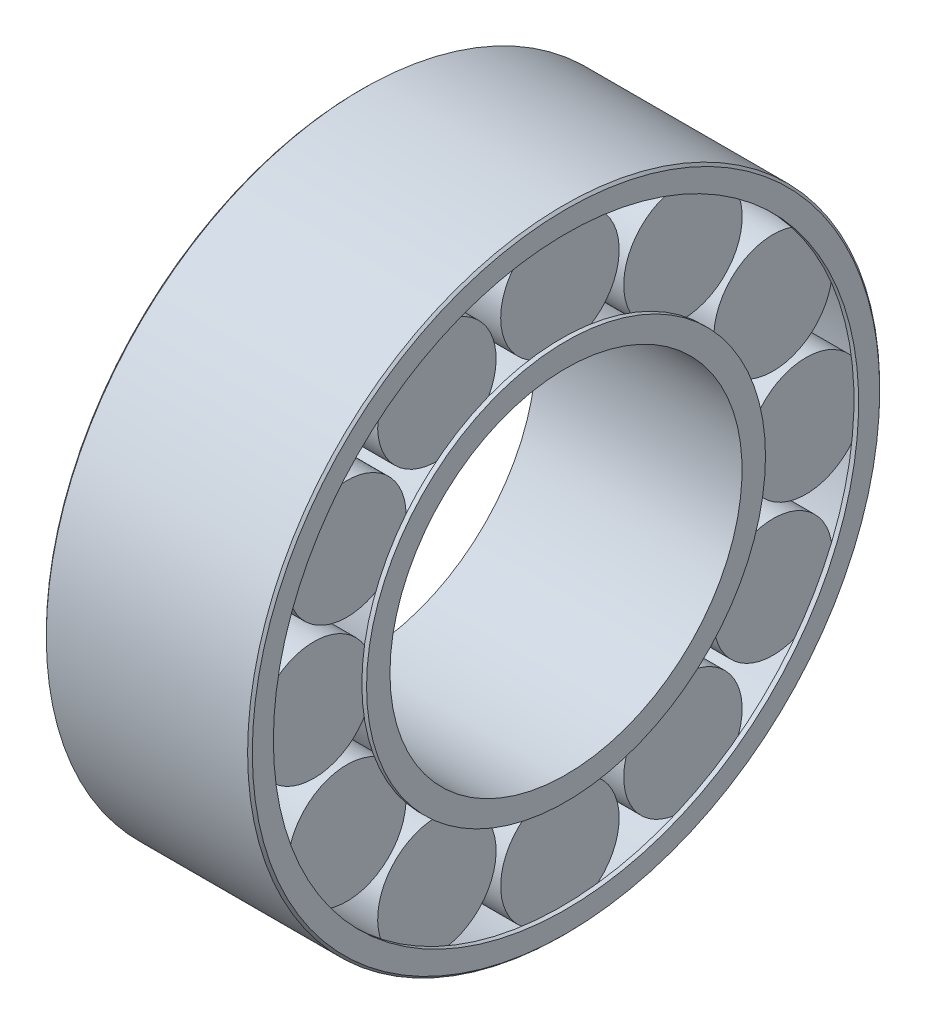
from build123d import *

# Parameters (mm, degrees)
SKETCH_2_W               = 41.4
SKETCH_2_H               = 12.65
PATTERN_CIRCULAR_3_COUNT = 12
CHAMFER_1_SIZE           = 0.5


with BuildPart() as part:
    # 草图1 → 旋转1 (revolve)
    with BuildSketch(Plane.XY, mode=Mode.PRIVATE) as revolve_1_sk:
        Polygon((0, 37.6), (44, 37.6), (44, 42.6), (43, 42.6), (43, 39.6), (1, 39.6), (1, 42.6), (0, 42.6), align=None)
        Polygon((0, 67.5), (44, 67.5), (44, 62.5), (43, 62.5), (43, 65.5), (1, 65.5), (1, 62.5), (0, 62.5), align=None)
    revolve(revolve_1_sk.sketch.rotate(Axis((0, 0, 0), (1, 0, 0)), 90), axis=Axis((0, 0, 0), (1, 0, 0)))

    # 倒角1
    chamfer_1_edges = [part.edges().sort_by_distance(p)[0] for p in [
        (0, 0, -67.5),
        (44, 0, -67.5),
    ]]
    chamfer(chamfer_1_edges, length=CHAMFER_1_SIZE)


with BuildPart() as body_2:
    # 草图2 → 旋转2 (revolve)
    with BuildSketch(Plane.XY, mode=Mode.PRIVATE) as revolve_2_sk:
        with Locations((22, 58.875)):
            Rectangle(SKETCH_2_W, SKETCH_2_H)
    revolve(revolve_2_sk.sketch.rotate(Axis((1.3, 52.55, 0), (1, 0, 0)), 90), axis=Axis((1.3, 52.55, 0), (1, 0, 0)))


with BuildPart() as pattern_circular_3_1:
    # 阵列(圆周)3: pattern copy
    add(body_2.part.rotate(Axis((0, 0, 0), (1, 0, 0)), 1 * 360 / PATTERN_CIRCULAR_3_COUNT))


with BuildPart() as pattern_circular_3_2:
    # 阵列(圆周)3: pattern copy
    add(body_2.part.rotate(Axis((0, 0, 0), (1, 0, 0)), 2 * 360 / PATTERN_CIRCULAR_3_COUNT))


with BuildPart() as pattern_circular_3_3:
    # 阵列(圆周)3: pattern copy
    add(body_2.part.rotate(Axis((0, 0, 0), (1, 0, 0)), 3 * 360 / PATTERN_CIRCULAR_3_COUNT))


with BuildPart() as pattern_circular_3_4:
    # 阵列(圆周)3: pattern copy
    add(body_2.part.rotate(Axis((0, 0, 0), (1, 0, 0)), 4 * 360 / PATTERN_CIRCULAR_3_COUNT))


with BuildPart() as pattern_circular_3_5:
    # 阵列(圆周)3: pattern copy
    add(body_2.part.rotate(Axis((0, 0, 0), (1, 0, 0)), 5 * 360 / PATTERN_CIRCULAR_3_COUNT))


with BuildPart() as pattern_circular_3_6:
    # 阵列(圆周)3: pattern copy
    add(body_2.part.rotate(Axis((0, 0, 0), (1, 0, 0)), 6 * 360 / PATTERN_CIRCULAR_3_COUNT))


with BuildPart() as pattern_circular_3_7:
    # 阵列(圆周)3: pattern copy
    add(body_2.part.rotate(Axis((0, 0, 0), (1, 0, 0)), 7 * 360 / PATTERN_CIRCULAR_3_COUNT))


with BuildPart() as pattern_circular_3_8:
    # 阵列(圆周)3: pattern copy
    add(body_2.part.rotate(Axis((0, 0, 0), (1, 0, 0)), 8 * 360 / PATTERN_CIRCULAR_3_COUNT))


with BuildPart() as pattern_circular_3_9:
    # 阵列(圆周)3: pattern copy
    add(body_2.part.rotate(Axis((0, 0, 0), (1, 0, 0)), 9 * 360 / PATTERN_CIRCULAR_3_COUNT))


with BuildPart() as pattern_circular_3_10:
    # 阵列(圆周)3: pattern copy
    add(body_2.part.rotate(Axis((0, 0, 0), (1, 0, 0)), 10 * 360 / PATTERN_CIRCULAR_3_COUNT))


with BuildPart() as pattern_circular_3_11:
    # 阵列(圆周)3: pattern copy
    add(body_2.part.rotate(Axis((0, 0, 0), (1, 0, 0)), 11 * 360 / PATTERN_CIRCULAR_3_COUNT))


solid = Compound([part.part, body_2.part, pattern_circular_3_1.part, pattern_circular_3_2.part, pattern_circular_3_3.part, pattern_circular_3_4.part, pattern_circular_3_5.part, pattern_circular_3_6.part, pattern_circular_3_7.part, pattern_circular_3_8.part, pattern_circular_3_9.part, pattern_circular_3_10.part, pattern_circular_3_11.part])
